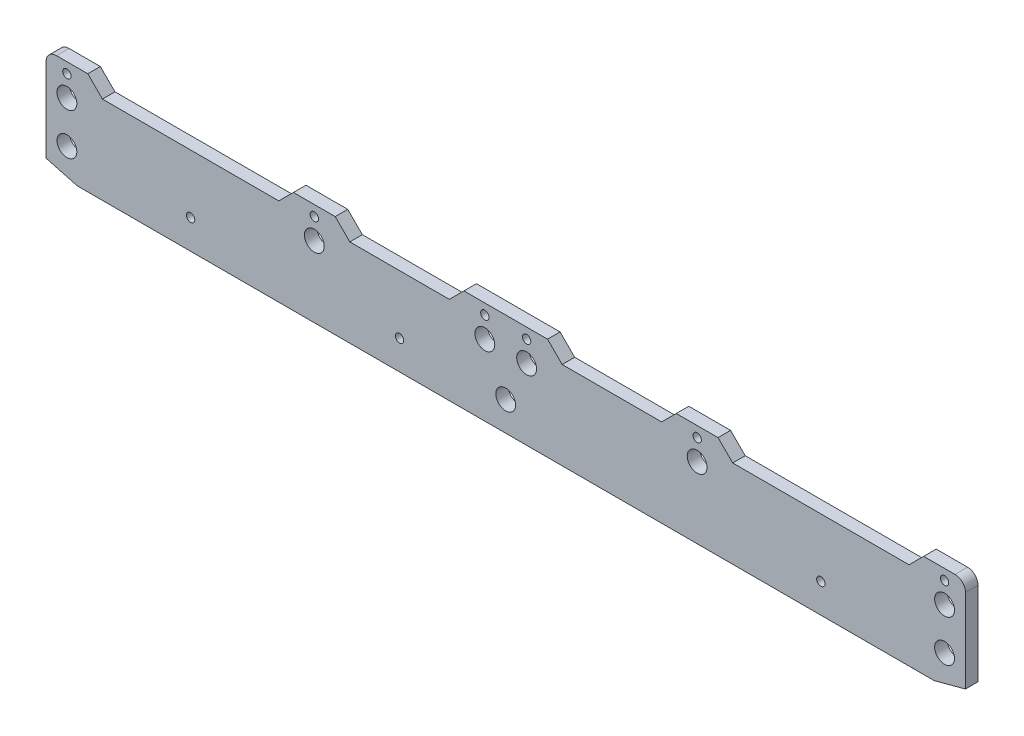
from build123d import *

# Parameters (mm, degrees)
CROQUIS1_R              = 4.75
SALIENTE_EXTRUIR1_DEPTH = 6
SALIENTE_EXTRUIR2_DEPTH = 6
CROQUIS3_R              = 2
CORTAR_EXTRUIR1_DEPTH   = 225.635259922
SALIENTE_EXTRUIR3_DEPTH = 6
REDONDEO3_R             = 5


with BuildPart() as part:
    # Croquis1 → Saliente-Extruir1 (new body)
    with BuildSketch(Plane.XY):
        Polygon((-220, 0), (220, 0), (220, 38), (108.6, 38), (101.6, 45), (81.6, 45), (74.6, 38), (27, 38), (20, 45), (-20, 45), (-27, 38), (-74.6, 38), (-81.6, 45), (-101.6, 45), (-108.6, 38), (-220, 38), align=None)
        with Locations((-210, 10)):
            Circle(CROQUIS1_R, mode=Mode.SUBTRACT)
        with Locations((-210, 30)):
            Circle(CROQUIS1_R, mode=Mode.SUBTRACT)
        with Locations(Location((210, 10, 0), (0, 0, 180))):
            Circle(CROQUIS1_R, mode=Mode.SUBTRACT)
        with Locations(Location((210, 30, 0), (0, 0, 180))):
            Circle(CROQUIS1_R, mode=Mode.SUBTRACT)
        with Locations((-91.6, 30)):
            Circle(CROQUIS1_R, mode=Mode.SUBTRACT)
        with Locations((-10, 30)):
            Circle(CROQUIS1_R, mode=Mode.SUBTRACT)
        with Locations(Location((10, 30, 0), (0, 0, 180))):
            Circle(CROQUIS1_R, mode=Mode.SUBTRACT)
        with Locations(Location((91.6, 30, 0), (0, 0, 180))):
            Circle(CROQUIS1_R, mode=Mode.SUBTRACT)
        with Locations((0, 10)):
            Circle(CROQUIS1_R, mode=Mode.SUBTRACT)
    extrude(amount=SALIENTE_EXTRUIR1_DEPTH)

    # Croquis2 → Saliente-Extruir2 (add)
    with BuildSketch(Plane.XY.offset(6)):
        Polygon((-220, 38), (-220, 45), (-200, 45), (-193, 38), align=None)
        Polygon((200, 45), (193, 38), (220, 38), (220, 45), align=None)
    extrude(amount=-SALIENTE_EXTRUIR2_DEPTH)

    # Croquis3 → Cortar-Extruir1 (cut, through all)
    with BuildSketch(Plane.XY.offset(6)):
        with Locations((-91.6, 40)):
            Circle(CROQUIS3_R)
        with Locations((-210, 40)):
            Circle(CROQUIS3_R)
        with Locations((-10, 40)):
            Circle(CROQUIS3_R)
        with Locations(Location((10, 40, 0), (0, 0, 180))):
            Circle(CROQUIS3_R)
        with Locations(Location((91.6, 40, 0), (0, 0, 180))):
            Circle(CROQUIS3_R)
        with Locations(Location((210, 40, 0), (0, 0, 180))):
            Circle(CROQUIS3_R)
        with Locations((-150.8, 10)):
            Circle(CROQUIS3_R)
        with Locations((-50.8, 10)):
            Circle(CROQUIS3_R)
        with Locations(Location((150.8, 10, 0), (0, 0, 180))):
            Circle(CROQUIS3_R)
    extrude(amount=-CORTAR_EXTRUIR1_DEPTH, mode=Mode.SUBTRACT)

    # Croquis4 → Saliente-Extruir3 (add)
    with BuildSketch(Plane.XY.offset(6)):
        Polygon((220, 0), (-220, 0), (-205.07179677, -4), (205.07179677, -4), align=None)
    extrude(amount=-SALIENTE_EXTRUIR3_DEPTH)

    # Redondeo3
    redondeo3_edges = [part.edges().sort_by_distance(p)[0] for p in [
        (-220, 45, 3),
        (220, 45, 3),
    ]]
    fillet(redondeo3_edges, radius=REDONDEO3_R)


solid = part.part
